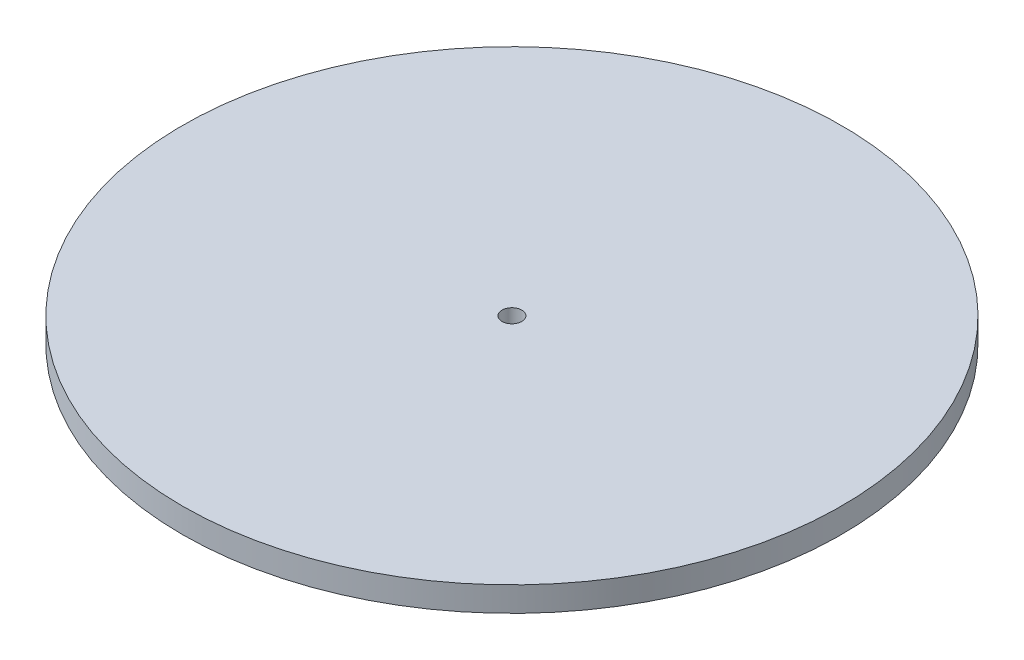
from build123d import *

# Parameters (mm, degrees)
SKETCH5_R          = 1.2
CUT_EXTRUDE1_DEPTH = 59.780548597


with BuildPart() as part:
    # Sketch3 → Revolve4 (revolve)
    with BuildSketch(Plane.XY, mode=Mode.PRIVATE) as revolve4_sk:
        with BuildLine():
            Line((1.2, 15.973505453), (1.2, 10.973505453))
            Line((1.2, 10.973505453), (0, 10.973505453))
            Line((0, 10.973505453), (0, 0))
            add(Edge.make_bspline(
                [(0, 0), (4.624999992, -0.000821627), (9.249999988, 0.895307711), (13.87499999, 2.734627001), (18.499999991, 4.379458464), (23.124999994, 6.355751803), (27.749999996, 8.209979743), (32.374999998, 10.111986172), (37, 11.973505453)],
                knots=[0.083466669, 0.083466669, 0.083466669, 0.083466669, 0.083466669, 0.083466669, 0.083466669, 0.083466669, 0.083466669, 0.918133361, 0.918133361, 0.918133361, 0.918133361, 0.918133361, 0.918133361, 0.918133361, 0.918133361, 0.918133361], degree=8))
            Line((37, 11.973505453), (37, 12.973505453))
            Line((37, 12.973505453), (40, 12.973505453))
            Line((40, 12.973505453), (40, 15.973505453))
            Line((40, 15.973505453), (1.2, 15.973505453))
        make_face()
    revolve(revolve4_sk.sketch.rotate(Axis((0, 15.973505453, 0), (0, -1, 0)), 90), axis=Axis((0, 15.973505453, 0), (0, -1, 0)))

    # Sketch5 → Cut-Extrude1 (cut, through all)
    with BuildSketch(Plane(origin=(0, 15.973505453, 0), x_dir=(1, 0, 0), z_dir=(0, 1, 0))):
        with Locations(Location((0, 0, 0), (0, 0, 270))):
            Circle(SKETCH5_R)
    extrude(amount=-CUT_EXTRUDE1_DEPTH, mode=Mode.SUBTRACT)


solid = part.part
